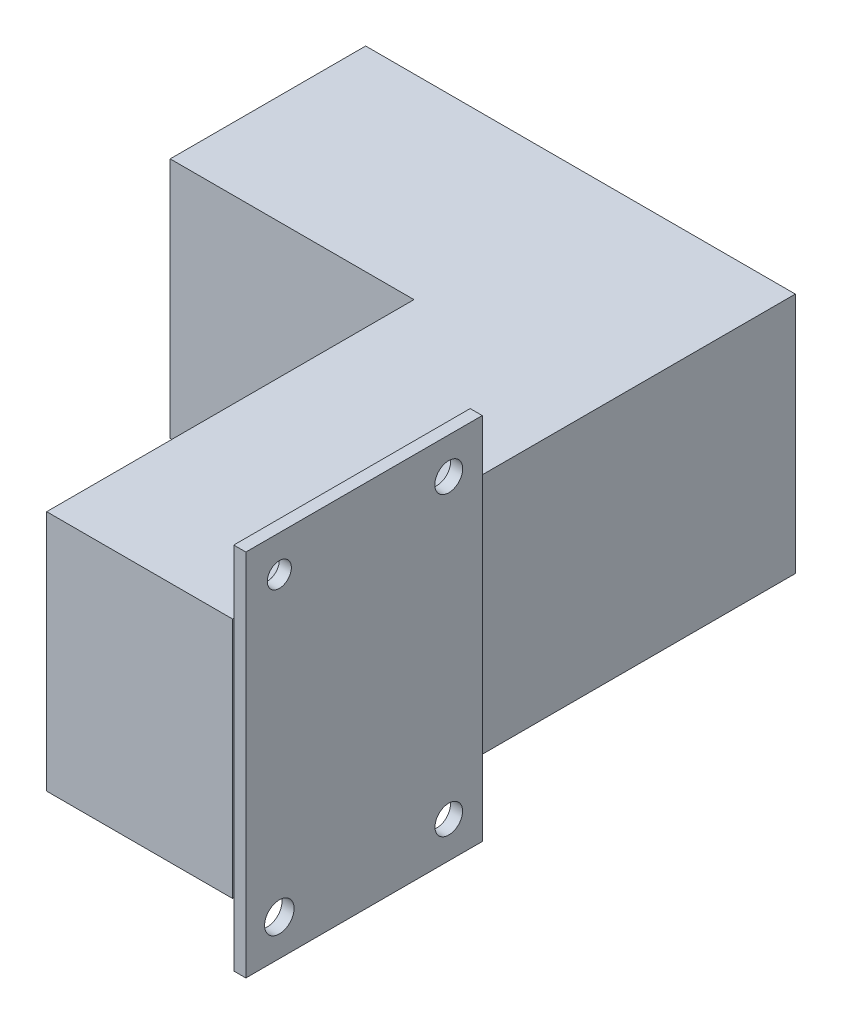
from build123d import *

# Parameters (mm, degrees)
SKETCH_1_W          = 71
SKETCH_1_H          = 40
EXTRUDE_1_DEPTH     = 93
EXTRUDE_START       = 35.5
SKETCH_2_W          = 39.063966261
SKETCH_2_H          = 60.96055705
SKETCH_2_R          = 1.986807663
SKETCH_2_R_2        = 2.303185406
SKETCH_2_R_3        = 2.435553703
SKETCH_2_R_4        = 2.279586572
EXTRUDE_2_DEPTH     = 2
CUT_EXTRUDE_1_DEPTH = 67


with BuildPart() as part:
    # 草图1 → 凸台-拉伸1 (new body)
    with BuildSketch(Plane.XY):
        Rectangle(SKETCH_1_W, SKETCH_1_H)
    extrude(amount=EXTRUDE_1_DEPTH)

    # 草图2 → 凸台-拉伸2 (add)
    with BuildSketch(Plane(origin=(0, 0, 0), x_dir=(0, 0, -1), z_dir=(1, 0, 0)).offset(EXTRUDE_START)):
        with Locations((-73.266758463, 0)):
            Rectangle(SKETCH_2_W, SKETCH_2_H)
        with Locations(Location((-87.266758464, 24.5, 0), (0, 0, 180))):
            Circle(SKETCH_2_R, mode=Mode.SUBTRACT)
        with Locations(Location((-59.266758464, 24.5, 0), (0, 0, 180))):
            Circle(SKETCH_2_R_2, mode=Mode.SUBTRACT)
        with Locations(Location((-87.266758464, -24.5, 0), (0, 0, 180))):
            Circle(SKETCH_2_R_3, mode=Mode.SUBTRACT)
        with Locations(Location((-59.266758464, -24.5, 0), (0, 0, 180))):
            Circle(SKETCH_2_R_4, mode=Mode.SUBTRACT)
    extrude(amount=EXTRUDE_2_DEPTH)

    # 草图3 → 切除-拉伸1 (cut)
    with BuildSketch(Plane(origin=(0, 20, 0), x_dir=(1, 0, 0), z_dir=(0, 1, 0))):
        Polygon((4.786467803, -93), (4.786467803, -32.304892778), (-35.5, -32.304892778), (-48.137036208, -34.916249884), (-56.319288473, -69.473208918), (-51.935451812, -90.687734689), (-39.693648232, -97.327684713), align=None)
    extrude(amount=-CUT_EXTRUDE_1_DEPTH, mode=Mode.SUBTRACT)


solid = part.part
